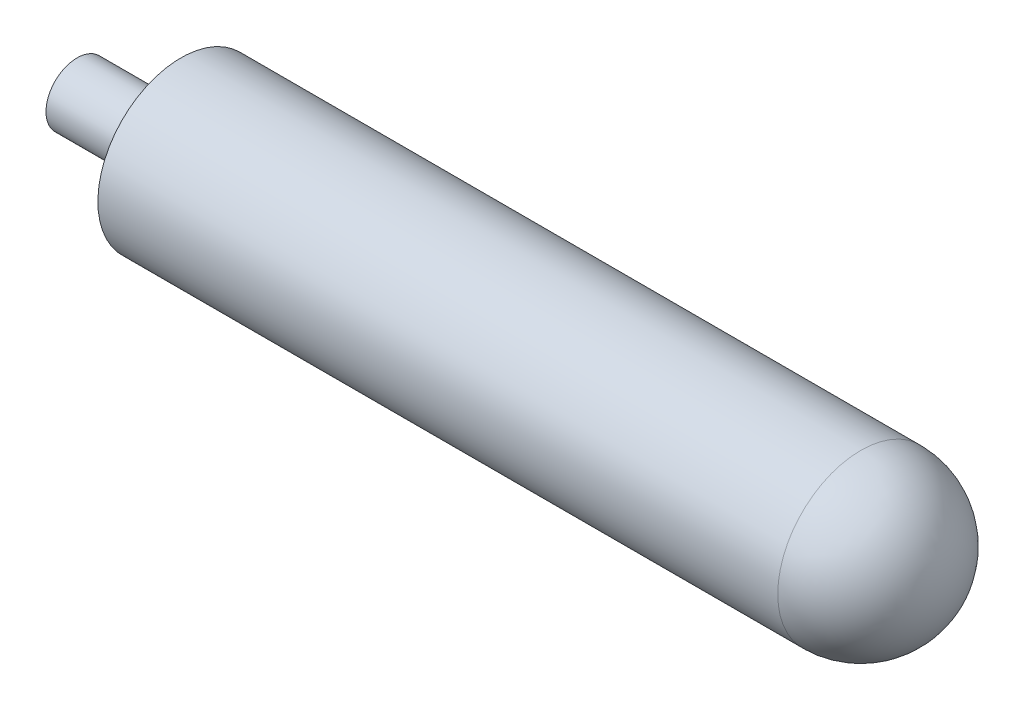
from build123d import *


with BuildPart() as part:
    # Sketch1 → Revolve1 (revolve)
    with BuildSketch(Plane.XY, mode=Mode.PRIVATE) as revolve1_sk:
        Polygon((6.5, 0), (6.5, 3), (16.5, 3), (16.5, 8), (68, 8), (68, 0), align=None)
    revolve(revolve1_sk.sketch.rotate(Axis((6.5, 0, 0), (1, 0, 0)), 180), axis=Axis((6.5, 0, 0), (1, 0, 0)))

    # Sketch2 → Revolve2 (revolve)
    with BuildSketch(Plane.XY, mode=Mode.PRIVATE) as revolve2_sk:
        with BuildLine():
            Line((68, 0), (68, 8))
            Line((68, 8), (82, 8))
            ThreePointArc((82, 8), (87.656854249, 5.656854249), (90, 0))
            Line((90, 0), (68, 0))
        make_face()
    revolve(revolve2_sk.sketch.rotate(Axis((0, 0, 0), (1, 0, 0)), 180), axis=Axis((0, 0, 0), (1, 0, 0)))


solid = part.part
